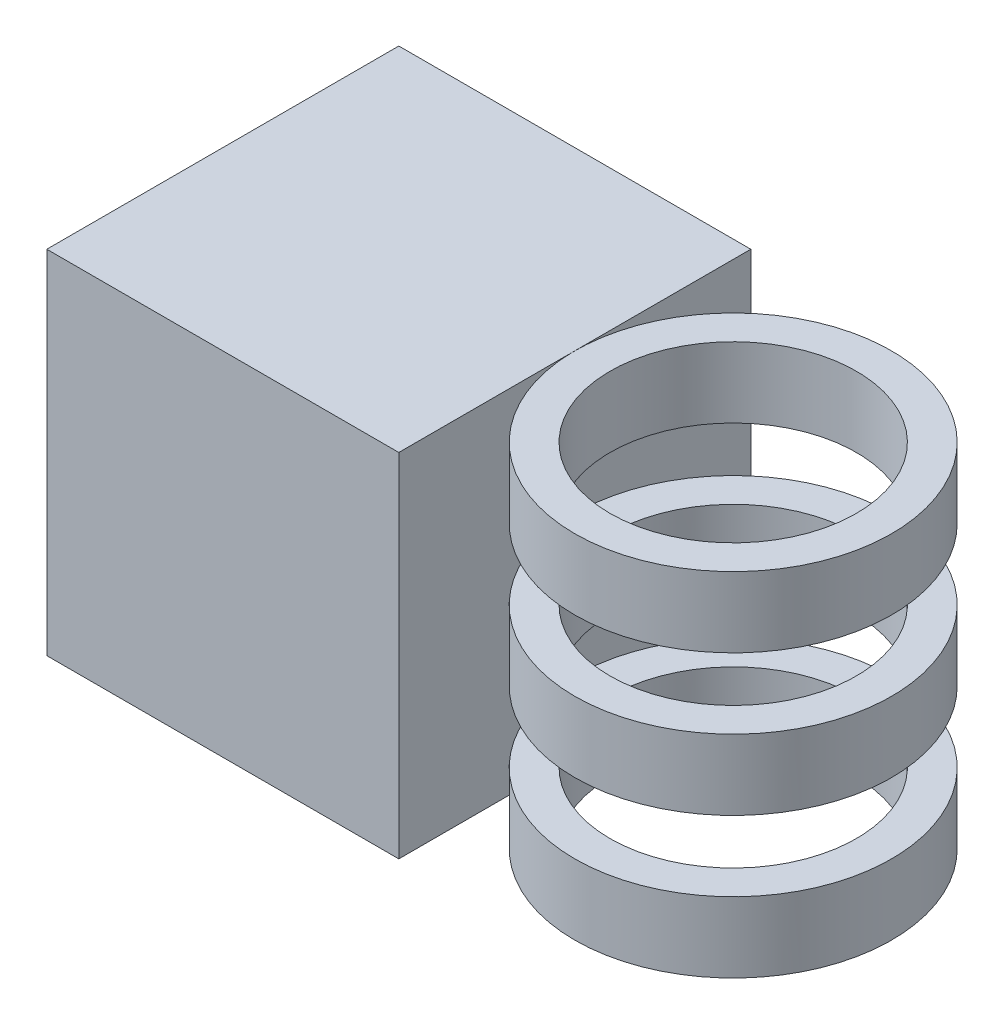
from build123d import *

# Parameters (mm, degrees)
SKETCH2_W           = 5
SKETCH2_H           = 5
BOSS_EXTRUDE1_DEPTH = 5
SKETCH7_R           = 2.25
SKETCH7_R_2         = 1.75
BOSS_EXTRUDE4_DEPTH = 5
SKETCH14_W          = 4.5
SKETCH14_H          = 1
CUT_EXTRUDE8_DEPTH  = 5


with BuildPart() as part:
    # Sketch2 → Boss-Extrude1 (new body)
    with BuildSketch(Plane.XY):
        with Locations((2.5, 2.5)):
            Rectangle(SKETCH2_W, SKETCH2_H)
    extrude(amount=BOSS_EXTRUDE1_DEPTH)


with BuildPart() as body_2:
    # Sketch7 → Boss-Extrude4 (new body)
    with BuildSketch(Plane(origin=(0, 5, 0), x_dir=(1, 0, 0), z_dir=(0, 1, 0))):
        with Locations(Location((7.25, -2.5, 0), (0, 0, 270))):
            Circle(SKETCH7_R)
        with Locations(Location((7.25, -2.5, 0), (0, 0, 270))):
            Circle(SKETCH7_R_2, mode=Mode.SUBTRACT)
    extrude(amount=-BOSS_EXTRUDE4_DEPTH)

    # Sketch14 → Cut-Extrude8 (cut)
    with BuildSketch(Plane.XY.offset(5)):
        with Locations((7.25, 3.5)):
            Rectangle(SKETCH14_W, SKETCH14_H)
        with Locations((7.25, 1.5)):
            Rectangle(SKETCH14_W, SKETCH14_H)
    extrude(amount=-CUT_EXTRUDE8_DEPTH, mode=Mode.SUBTRACT)


with BuildPart() as cut_extrude8_piece_1:
    # of the separate pieces the step leaves, piece 1, a body of its own (cut_extrude8_pieces)
    add(body_2.part.solids().sort_by_distance((7.25, 3, 4.75))[0])


with BuildPart() as cut_extrude8_piece_2:
    # of the separate pieces the step leaves, piece 2, a body of its own (cut_extrude8_pieces)
    add(body_2.part.solids().sort_by_distance((7.25, 1, 4.75))[0])


with BuildPart() as cut_extrude8_piece_3:
    # of the separate pieces the step leaves, piece 3, a body of its own (cut_extrude8_pieces)
    add(body_2.part.solids().sort_by_distance((7.25, 5, 4.75))[0])


solid = Compound([part.part, cut_extrude8_piece_1.part, cut_extrude8_piece_2.part, cut_extrude8_piece_3.part])
